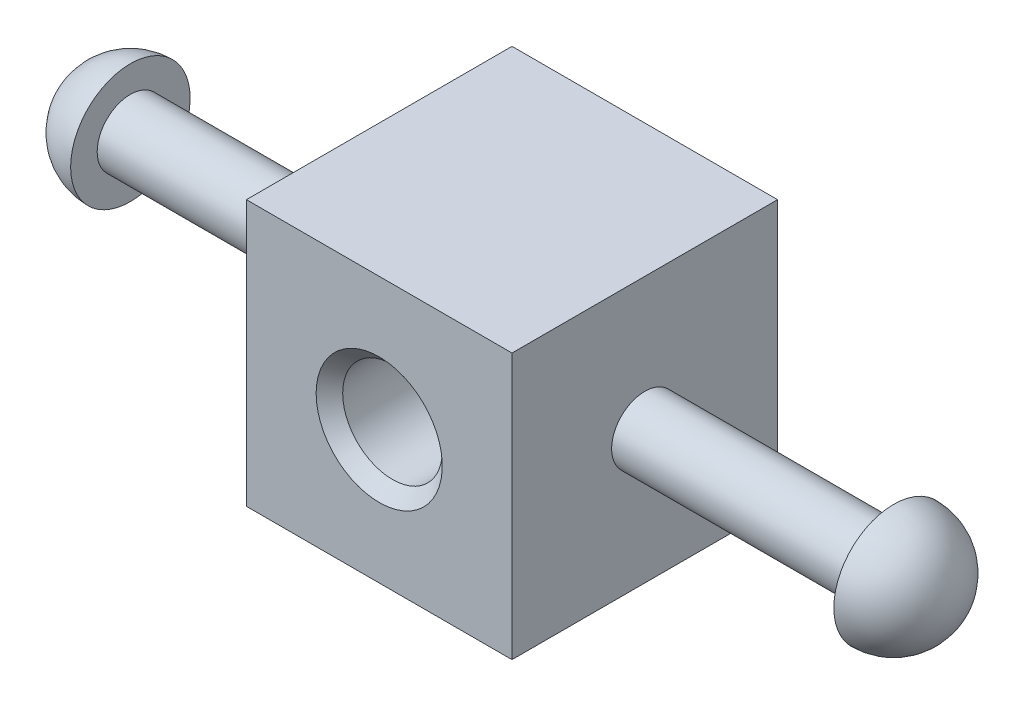
from build123d import *

# Parameters (mm, degrees)
SKETCH1_W           = 25.4
SKETCH1_H           = 25.4
BOSS_EXTRUDE1_DEPTH = 25.4
SKETCH2_R           = 4.7625
CUT_EXTRUDE1_DEPTH  = 25.4
CHAMFER1_SIZE       = 1.27
CHAMFER2_SIZE       = 1.27


with BuildPart() as part:
    # Sketch1 → Boss-Extrude1 (new body)
    with BuildSketch(Plane(origin=(0, 0, 0), x_dir=(1, 0, 0), z_dir=(0, 1, 0))):
        Rectangle(SKETCH1_W, SKETCH1_H)
    extrude(amount=BOSS_EXTRUDE1_DEPTH)

    # Sketch2 → Cut-Extrude1 (cut)
    with BuildSketch(Plane.XY.offset(12.7)):
        with Locations((0, 12.7)):
            Circle(SKETCH2_R)
    extrude(amount=-CUT_EXTRUDE1_DEPTH, mode=Mode.SUBTRACT)

    # Chamfer1
    chamfer1_edges = [part.edges().sort_by_distance(p)[0] for p in [
        (-4.7625, 12.7, 12.7),
    ]]
    chamfer(chamfer1_edges, length=CHAMFER1_SIZE)

    # Chamfer2
    chamfer2_edges = [part.edges().sort_by_distance(p)[0] for p in [
        (-4.7625, 12.7, -12.7),
    ]]
    chamfer(chamfer2_edges, length=CHAMFER2_SIZE)

    # Sketch5 → Revolve-Thin4 (revolve)
    with BuildSketch(Plane.XY):
        with BuildLine():
            Line((12.7, 15.875), (36.497053043, 15.875))
            Line((36.497053043, 15.875), (36.497053043, 18.415))
            ThreePointArc((36.497053043, 18.415), (40.538168298, 16.741115254), (42.212053043, 12.7))
            Line((42.212053043, 12.7), (39.672053043, 12.7))
            ThreePointArc((39.672053043, 12.7), (39.509122515, 13.704023157), (39.037053043, 14.605))
            Line((39.037053043, 14.605), (39.037053043, 13.335))
            Line((39.037053043, 13.335), (12.7, 13.335))
            Line((12.7, 13.335), (12.7, 15.875))
        make_face()
    revolve_thin4 = revolve(axis=Axis((12.7, 12.7, 0), (1, 0, 0)))

    # Mirror1: Revolve-Thin4 across plane
    add(revolve_thin4.mirror(Plane.ZY))


solid = part.part
